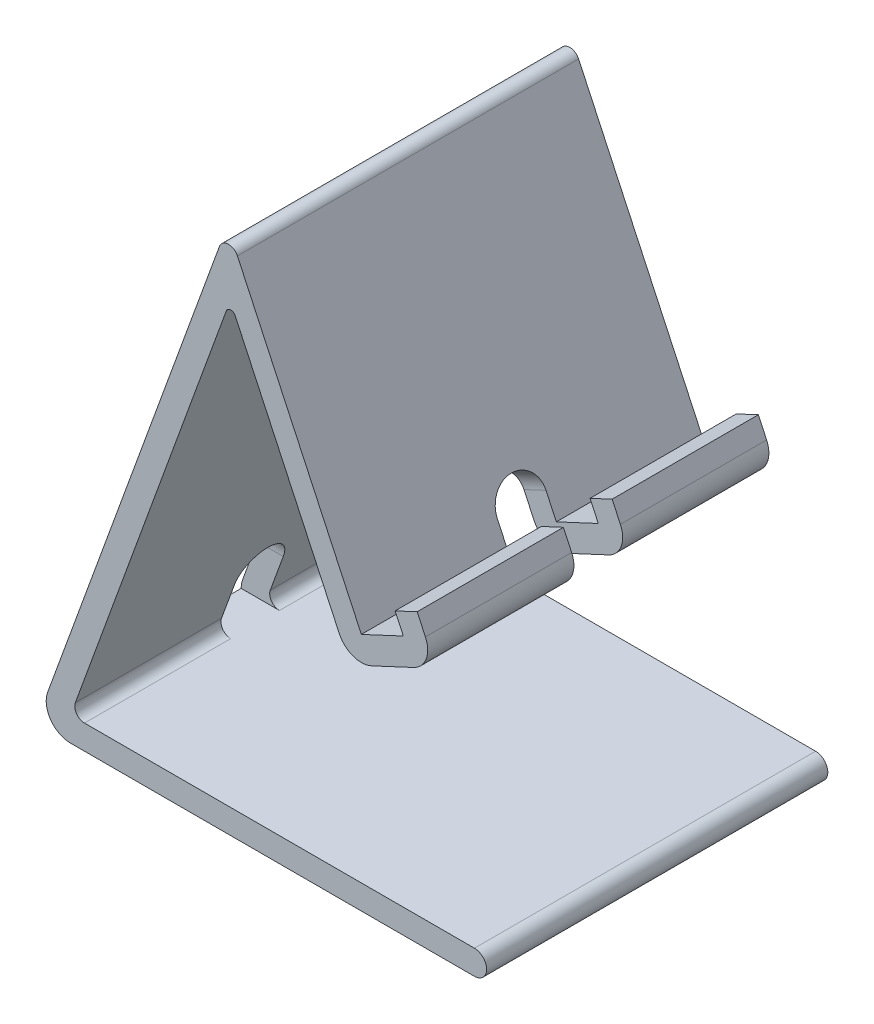
from build123d import *

# Parameters (mm, degrees)
BOSS_EXTRUDE1_DEPTH     = 70
CUT_EXTRUDE2_DEPTH      = 40
CUT_EXTRUDE2_DEPTH_BACK = 40
CUT_EXTRUDE4_DEPTH      = 20


with BuildPart() as part:
    # Sketch1 → Boss-Extrude1 (new body)
    with BuildSketch(Plane.XY):
        with BuildLine():
            ThreePointArc((7.140740034, 0), (3.044979812, 2.132117818), (2.44227693, 6.710100717))
            Line((2.44227693, 6.710100717), (37.680897145, 103.527414051))
            ThreePointArc((37.680897145, 103.527414051), (39.473043612, 104.841470208), (41.372897961, 103.688610288))
            Line((41.372897961, 103.688610288), (66.802503496, 49.154645233))
            Line((66.802503496, 49.154645233), (75.412427472, 53.16951872))
            Line((75.412427472, 53.16951872), (73.721954425, 56.794749868))
            Line((73.721954425, 56.794749868), (78.253493361, 58.907841176))
            Line((78.253493361, 58.907841176), (79.943966408, 55.282610028))
            ThreePointArc((79.943966408, 55.282610028), (80.110890576, 51.459418003), (77.525518781, 48.637979784))
            Line((77.525518781, 48.637979784), (68.915594804, 44.623106298))
            ThreePointArc((68.915594804, 44.623106298), (65.092402779, 44.456182129), (62.27096456, 47.041553924))
            Line((62.27096456, 47.041553924), (40.922521982, 92.823436775))
            ThreePointArc((40.922521982, 92.823436775), (39.972594808, 93.399866735), (39.076521575, 92.742838656))
            Line((39.076521575, 92.742838656), (8.117650806, 7.684040287))
            ThreePointArc((8.117650806, 7.684040287), (8.358731959, 5.852847127), (9.997036047, 5))
            Line((9.997036047, 5), (90, 5))
            ThreePointArc((90, 5), (92.5, 2.5), (90, 0))
            Line((90, 0), (7.140740034, 0))
        make_face()
    extrude(amount=-BOSS_EXTRUDE1_DEPTH)

    # Sketch2 → Cut-Extrude2 (cut, two sides: drawn at the far end of the back side and taken through both)
    with BuildSketch(Plane(origin=(73.698483936, 34.366167454, 0), x_dir=(0, 0, -1), z_dir=(0.9063077870366539, 0.422618261740691, 0)).offset(-CUT_EXTRUDE2_DEPTH_BACK)):
        with BuildLine():
            Line((40, 16.317279836), (40, 21.317279836))
            ThreePointArc((40, 21.317279836), (35, 26.317279836), (30, 21.317279836))
            Line((30, 21.317279836), (30, 16.317279836))
            Line((30, 16.317279836), (30, 11.317279836))
            Line((30, 11.317279836), (40, 11.317279836))
            Line((40, 11.317279836), (40, 16.317279836))
        make_face()
    extrude(amount=CUT_EXTRUDE2_DEPTH + CUT_EXTRUDE2_DEPTH_BACK, mode=Mode.SUBTRACT)

    # Sketch5 → Cut-Extrude4 (cut)
    with BuildSketch(Plane(origin=(0, 0, 0), x_dir=(0, 0, -1), z_dir=(1, 0, 0))):
        with BuildLine():
            Line((40, 10), (40, 15))
            ThreePointArc((40, 15), (35, 20), (30, 15))
            Line((30, 15), (30, 10))
            Line((30, 10), (30, 5))
            Line((30, 5), (40, 5))
            Line((40, 5), (40, 10))
        make_face()
    extrude(amount=CUT_EXTRUDE4_DEPTH, mode=Mode.SUBTRACT)


solid = part.part
